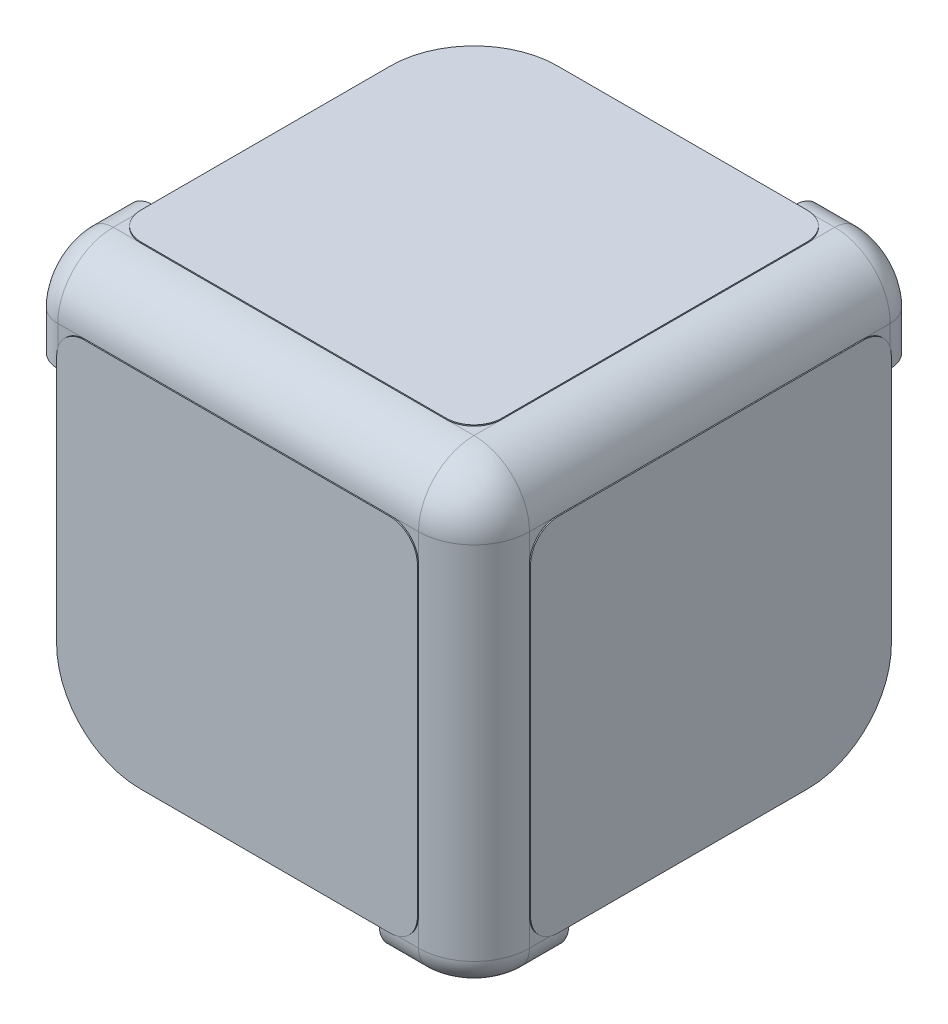
from build123d import *

# Parameters (mm, degrees)
SKETCH1_W           = 40
SKETCH1_H           = 40
BOSS_EXTRUDE1_DEPTH = 40
SKETCH4_W           = 40
SKETCH4_H           = 40
CUT_EXTRUDE1_DEPTH  = 5
SKETCH5_W           = 40
SKETCH5_H           = 40
CUT_EXTRUDE2_DEPTH  = 5
SKETCH6_W           = 40
SKETCH6_H           = 40
CUT_EXTRUDE3_DEPTH  = 5
FILLET1_R           = 5
BOSS_EXTRUDE2_START = 5
BOSS_EXTRUDE2_DEPTH = 5
FILLET2_R           = 2.5
BOSS_EXTRUDE3_DEPTH = 0.1


with BuildPart() as part:
    # Sketch1 → Boss-Extrude1 (new body)
    with BuildSketch(Plane(origin=(0, 0, 0), x_dir=(0, 1, 0), z_dir=(0, 0, 1))):
        with Locations((20, -20)):
            Rectangle(SKETCH1_W, SKETCH1_H)
    extrude(amount=BOSS_EXTRUDE1_DEPTH)

    # Sketch2 → Cut-Revolve1 (revolve, cut)
    with BuildSketch(Plane.XZ):
        with BuildLine():
            Line((0, 42), (0, -42))
            ThreePointArc((0, -42), (42, 0), (0, 42))
        make_face()
    revolve(axis=Axis((0, 0, 42), (0, 0, -1)), mode=Mode.SUBTRACT)

    # Sketch4 → Cut-Extrude1 (cut)
    with BuildSketch(Plane.XZ):
        with Locations((20, 20)):
            Rectangle(SKETCH4_W, SKETCH4_H)
    extrude(amount=-CUT_EXTRUDE1_DEPTH, mode=Mode.SUBTRACT)

    # Sketch5 → Cut-Extrude2 (cut)
    with BuildSketch(Plane(origin=(0, 0, 0), x_dir=(0, -1, 0), z_dir=(-1, 0, 0))):
        with Locations((-20, 20)):
            Rectangle(SKETCH5_W, SKETCH5_H)
    extrude(amount=-CUT_EXTRUDE2_DEPTH, mode=Mode.SUBTRACT)

    # Sketch6 → Cut-Extrude3 (cut)
    with BuildSketch(Plane(origin=(0, 0, 0), x_dir=(1, 0, 0), z_dir=(0, 0, -1))):
        with Locations((20, -20)):
            Rectangle(SKETCH6_W, SKETCH6_H)
    extrude(amount=-CUT_EXTRUDE3_DEPTH, mode=Mode.SUBTRACT)

    # Fillet1
    fillet1_edges = [part.edges().sort_by_distance(p)[0] for p in [
        (22.5, 40, 40),
        (40, 22.5, 40),
        (40, 40, 22.5),
    ]]
    fillet(fillet1_edges, radius=FILLET1_R)

    # Sketch7 → Boss-Extrude2 (add)
    with BuildSketch(Plane.XZ.offset(-5).offset(BOSS_EXTRUDE2_START)):
        with BuildLine():
            Line((31.464466094, 40), (31.464466094, 35))
            Line((31.464466094, 35), (35, 31.464466094))
            Line((35, 31.464466094), (40, 31.464466094))
            Line((40, 31.464466094), (40, 35))
            ThreePointArc((40, 35), (38.535533906, 38.535533906), (35, 40))
            Line((35, 40), (31.464466094, 40))
        make_face()
    boss_extrude2 = extrude(amount=-BOSS_EXTRUDE2_DEPTH)

    # Mirror1: Boss-Extrude2 across plane
    add(boss_extrude2.mirror(Plane(origin=(0, 0, 0), x_dir=(0, 0.7071067811865476, 0.7071067811865476), z_dir=(0, 0.7071067811865477, -0.7071067811865475))))

    # Mirror1 at the second plane: Boss-Extrude2 across plane
    add(boss_extrude2.mirror(Plane(origin=(0, 0, 0), x_dir=(0, 0, 1), z_dir=(-0.7071067811865476, 0.7071067811865475, 0))))

    # Fillet2
    fillet2_edges = [part.edges().sort_by_distance(p)[0] for p in [
        (38.535533906, 0, 38.535533906),
        (33.232233047, 0, 40),
        (40, 0, 33.232233047),
        (0, 38.535533906, 38.535533906),
        (0, 40, 33.232233047),
        (0, 33.232233047, 40),
        (38.535533906, 38.535533906, 0),
        (40, 33.232233047, 0),
        (33.232233047, 40, 0),
    ]]
    fillet(fillet2_edges, radius=FILLET2_R)

    # Sketch9 → Boss-Extrude3 (add)
    with BuildSketch(Plane.YZ.offset(40)):
        with BuildLine():
            Line((32.5, 35), (5, 35))
            ThreePointArc((5, 35), (3.232233047, 34.267766953), (2.5, 32.5))
            Line((2.5, 32.5), (2.5, 10))
            ThreePointArc((2.5, 10), (4.696699141, 4.696699141), (10, 2.5))
            Line((10, 2.5), (32.5, 2.5))
            ThreePointArc((32.5, 2.5), (34.267766953, 3.232233047), (35, 5))
            Line((35, 5), (35, 32.5))
            ThreePointArc((35, 32.5), (34.267766953, 34.267766953), (32.5, 35))
        make_face()
    boss_extrude3 = extrude(amount=BOSS_EXTRUDE3_DEPTH)

    # Mirror2: Boss-Extrude3 across plane
    add(boss_extrude3.mirror(Plane(origin=(0, 0, 0), x_dir=(0.7071067811865475, 0, 0.7071067811865476), z_dir=(0.7071067811865478, 0, -0.7071067811865474))))

    # Mirror2 at the second plane: Boss-Extrude3 across plane
    add(boss_extrude3.mirror(Plane(origin=(0, 0, 0), x_dir=(0, 0, 1), z_dir=(-0.7071067811865476, 0.7071067811865475, 0))))


solid = part.part
